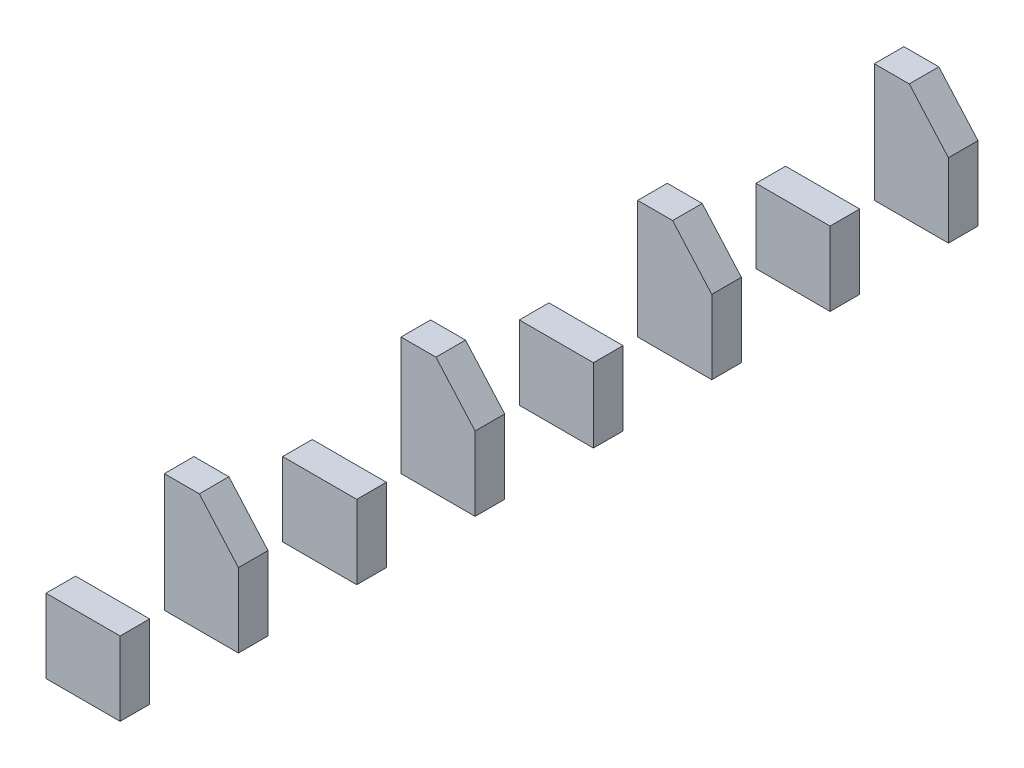
from build123d import *

# Parameters (mm, degrees)
BOSS_EXTRUDE1_DEPTH = 25.4
SKETCH2_W           = 63.621244455
SKETCH2_H           = 63.5
BOSS_EXTRUDE2_DEPTH = 25.4
LPATTERN1_COUNT     = 4
LPATTERN1_PITCH     = 203.2
LPATTERN2_COUNT     = 4
LPATTERN2_PITCH     = 203.2


with BuildPart() as part:
    # Sketch1 → Boss-Extrude1 (new body)
    with BuildSketch(Plane.XY):
        Polygon((0, 0), (0, 101.6), (30.020202805, 101.6), (63.621244455, 63.5), (63.621244455, 0), align=None)
    boss_extrude1 = extrude(amount=BOSS_EXTRUDE1_DEPTH)


with BuildPart() as body_2:
    # Sketch2 → Boss-Extrude2 (new body)
    with BuildSketch(Plane.XY.offset(101.6)):
        with Locations((31.810622228, 31.75)):
            Rectangle(SKETCH2_W, SKETCH2_H)
    boss_extrude2 = extrude(amount=BOSS_EXTRUDE2_DEPTH)


with BuildPart() as lpattern1_1:
    # LPattern1: Boss-Extrude1 ×4
    with Locations(*[(0, 0, i * LPATTERN1_PITCH) for i in range(1, LPATTERN1_COUNT)]):
        add(boss_extrude1)


with BuildPart() as lpattern2_1:
    # LPattern2: Boss-Extrude2 ×4
    with Locations(*[(0, 0, i * LPATTERN2_PITCH) for i in range(1, LPATTERN2_COUNT)]):
        add(boss_extrude2)


solid = Compound([part.part, body_2.part, lpattern1_1.part, lpattern2_1.part])
